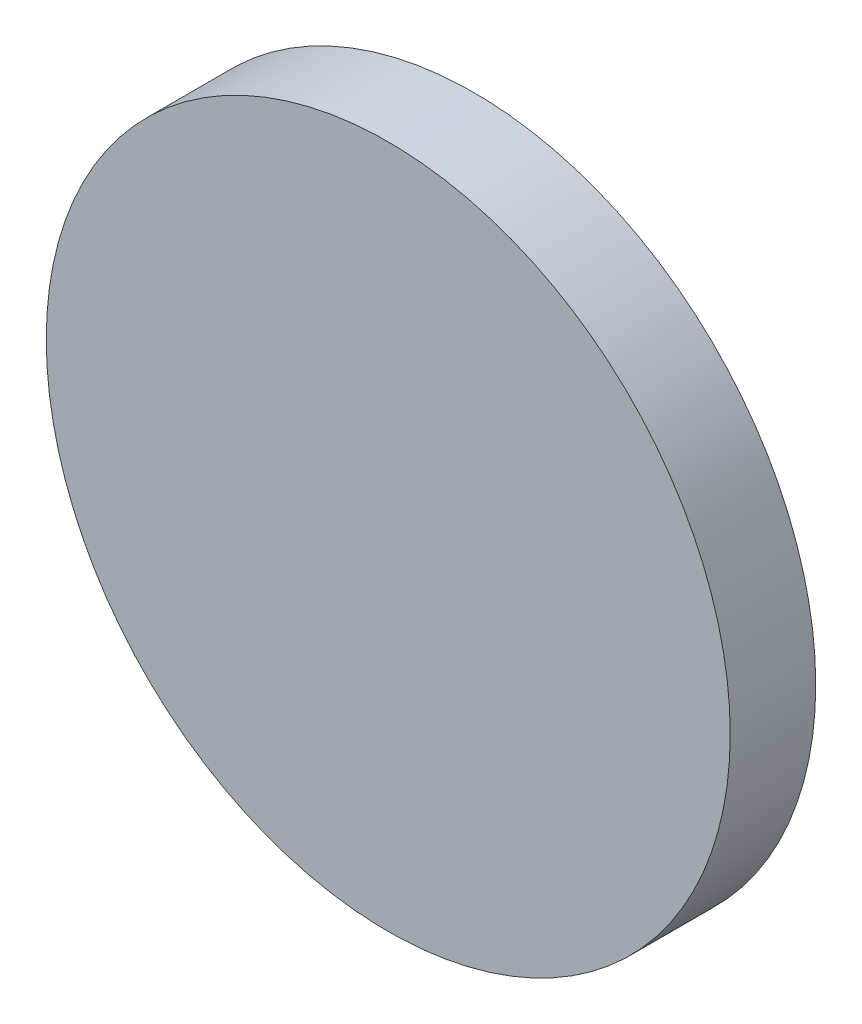
from build123d import *

# Parameters (mm, degrees)
SKETCH1_R           = 8
BOSS_EXTRUDE1_DEPTH = 2


with BuildPart() as part:
    # Sketch1 → Boss-Extrude1 (new body)
    with BuildSketch(Plane.XY):
        Circle(SKETCH1_R)
    extrude(amount=BOSS_EXTRUDE1_DEPTH)


solid = part.part
